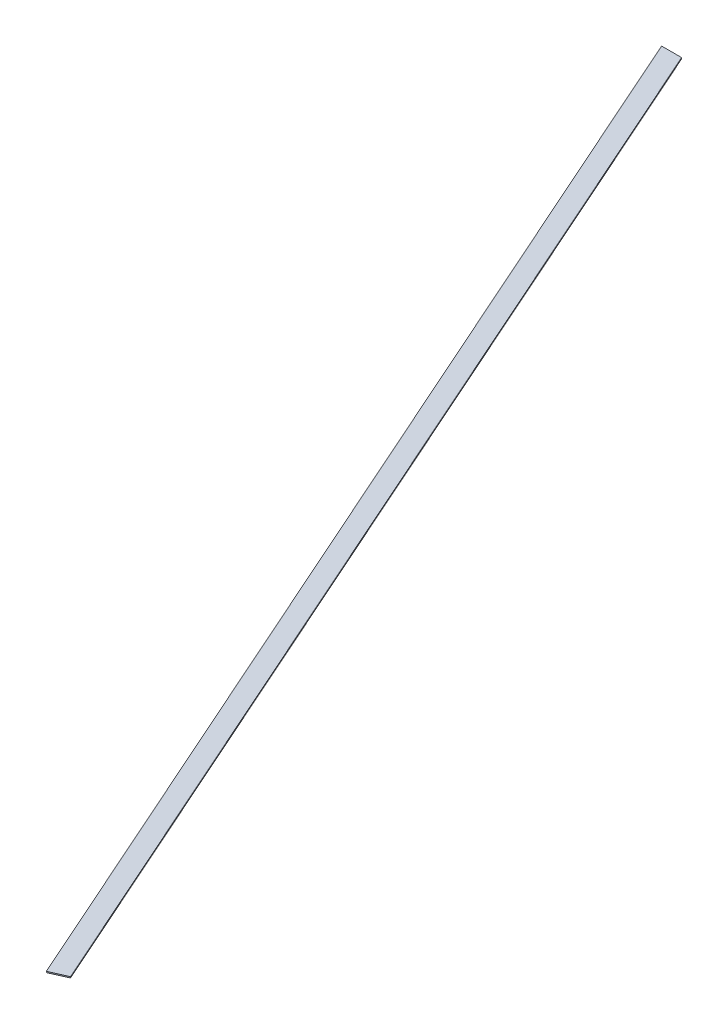
from build123d import *

# Parameters (mm, degrees)
BOSS_EXTRUDE1_DEPTH = 3.175
CUT_EXTRUDE1_DEPTH  = 4516.590721132


with BuildPart() as part:
    # Sketch1 → Boss-Extrude1 (new body)
    with BuildSketch(Plane(origin=(0, 0, 0), x_dir=(1, 0, 0), z_dir=(0, 1, 0))):
        Polygon((27.803761474, 0), (-1804.223232834, 4114.8), (-1859.830755782, 4114.8), (-27.803761474, 0), align=None)
    extrude(amount=BOSS_EXTRUDE1_DEPTH)

    # Sketch2 → Cut-Extrude1 (cut, through all)
    with BuildSketch(Plane(origin=(0, 3.175, 0), x_dir=(1, 0, 0), z_dir=(0, 1, 0))):
        Polygon((27.803761474, 0), (-444.327999075, 1060.425296322), (-490.736108324, 1039.763074854), (-27.803761474, 0), align=None)
    extrude(amount=-CUT_EXTRUDE1_DEPTH, mode=Mode.SUBTRACT)


solid = part.part
